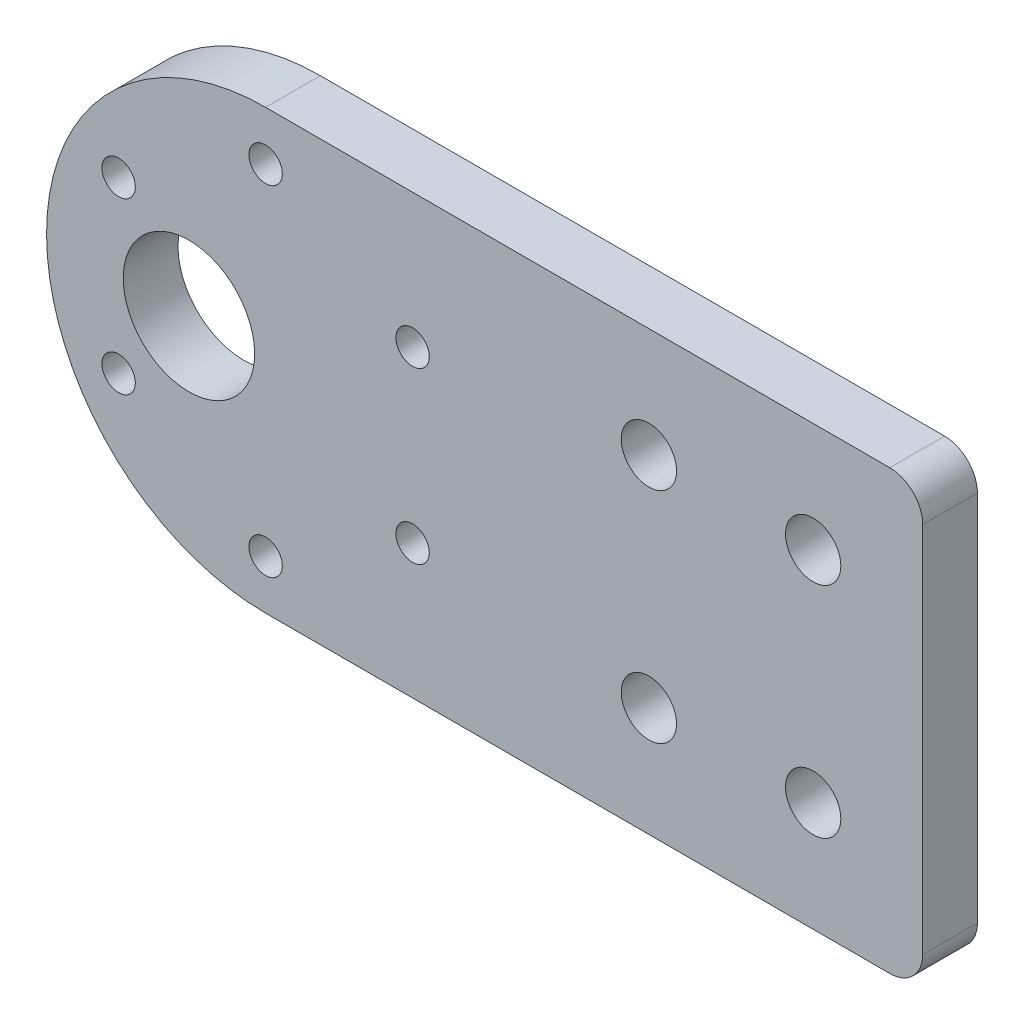
from build123d import *

# Parameters (mm, degrees)
SKETCH1_W           = 80
SKETCH1_H           = 40
BOSS_EXTRUDE1_DEPTH = 5
CUT_EXTRUDE4_REACH  = 91.582
CUT_EXTRUDE5_REACH  = 91.582
SKETCH11_R          = 2.525
FILLET1_R           = 3
CUT_EXTRUDE9_REACH  = 91.582
SKETCH19_R          = 1.525
SKETCH19_R_2        = 6


with BuildPart() as part:
    # Sketch1 → Boss-Extrude1 (new body)
    with BuildSketch(Plane.XY):
        with Locations((40, 20)):
            Rectangle(SKETCH1_W, SKETCH1_H)
    extrude(amount=BOSS_EXTRUDE1_DEPTH)

    # Sketch10 → Cut-Extrude4 (cut, up to next)
    with BuildSketch(Plane.XY.offset(5), mode=Mode.PRIVATE) as cut_extrude4_sk1:
        with BuildLine():
            ThreePointArc((20, 0), (5.857864376, 5.857864376), (0, 20))
            Line((0, 20), (0, 0))
            Line((0, 0), (20, 0))
        make_face()
    cut_extrude4_tool1 = extrude(cut_extrude4_sk1.sketch, amount=-CUT_EXTRUDE4_REACH, mode=Mode.PRIVATE) & part.part
    # Sketch10 → Cut-Extrude4 (cut, up to next)
    with BuildSketch(Plane.XY.offset(5), mode=Mode.PRIVATE) as cut_extrude4_sk2:
        with BuildLine():
            Line((20, 40), (0, 40))
            Line((0, 40), (0, 20))
            ThreePointArc((0, 20), (5.857864376, 34.142135624), (20, 40))
        make_face()
    cut_extrude4_tool2 = extrude(cut_extrude4_sk2.sketch, amount=-CUT_EXTRUDE4_REACH, mode=Mode.PRIVATE) & part.part
    add(cut_extrude4_tool1.solids().sort_by_distance((4.467359, 4.467359, 5))[0], mode=Mode.SUBTRACT)
    add(cut_extrude4_tool2.solids().sort_by_distance((4.467359, 35.532641, 5))[0], mode=Mode.SUBTRACT)

    # Sketch11 → Cut-Extrude5 (cut, up to next)
    with BuildSketch(Plane.XY.offset(5), mode=Mode.PRIVATE) as cut_extrude5_sk1:
        with Locations((55, 30)):
            Circle(SKETCH11_R)
    cut_extrude5_tool1 = extrude(cut_extrude5_sk1.sketch, amount=-CUT_EXTRUDE5_REACH, mode=Mode.PRIVATE) & part.part
    # Sketch11 → Cut-Extrude5 (cut, up to next)
    with BuildSketch(Plane.XY.offset(5), mode=Mode.PRIVATE) as cut_extrude5_sk2:
        with Locations((70, 30)):
            Circle(SKETCH11_R)
    cut_extrude5_tool2 = extrude(cut_extrude5_sk2.sketch, amount=-CUT_EXTRUDE5_REACH, mode=Mode.PRIVATE) & part.part
    # Sketch11 → Cut-Extrude5 (cut, up to next)
    with BuildSketch(Plane.XY.offset(5), mode=Mode.PRIVATE) as cut_extrude5_sk3:
        with Locations((55, 10)):
            Circle(SKETCH11_R)
    cut_extrude5_tool3 = extrude(cut_extrude5_sk3.sketch, amount=-CUT_EXTRUDE5_REACH, mode=Mode.PRIVATE) & part.part
    # Sketch11 → Cut-Extrude5 (cut, up to next)
    with BuildSketch(Plane.XY.offset(5), mode=Mode.PRIVATE) as cut_extrude5_sk4:
        with Locations((70, 10)):
            Circle(SKETCH11_R)
    cut_extrude5_tool4 = extrude(cut_extrude5_sk4.sketch, amount=-CUT_EXTRUDE5_REACH, mode=Mode.PRIVATE) & part.part
    add(cut_extrude5_tool1.solids().sort_by_distance((55, 30, 5))[0], mode=Mode.SUBTRACT)
    add(cut_extrude5_tool2.solids().sort_by_distance((70, 30, 5))[0], mode=Mode.SUBTRACT)
    add(cut_extrude5_tool3.solids().sort_by_distance((55, 10, 5))[0], mode=Mode.SUBTRACT)
    add(cut_extrude5_tool4.solids().sort_by_distance((70, 10, 5))[0], mode=Mode.SUBTRACT)

    # Fillet1
    fillet1_edges = [part.edges().sort_by_distance(p)[0] for p in [
        (80, 40, 2.5),
        (80, 0, 2.5),
    ]]
    fillet(fillet1_edges, radius=FILLET1_R)

    # Sketch19 → Cut-Extrude9 (cut, up to next)
    with BuildSketch(Plane.XY.offset(5), mode=Mode.PRIVATE) as cut_extrude9_sk1:
        with Locations((20, 35.5)):
            Circle(SKETCH19_R)
    cut_extrude9_tool1 = extrude(cut_extrude9_sk1.sketch, amount=-CUT_EXTRUDE9_REACH, mode=Mode.PRIVATE) & part.part
    # Sketch19 → Cut-Extrude9 (cut, up to next)
    with BuildSketch(Plane.XY.offset(5), mode=Mode.PRIVATE) as cut_extrude9_sk2:
        with Locations((33.423393759, 27.75)):
            Circle(SKETCH19_R)
    cut_extrude9_tool2 = extrude(cut_extrude9_sk2.sketch, amount=-CUT_EXTRUDE9_REACH, mode=Mode.PRIVATE) & part.part
    # Sketch19 → Cut-Extrude9 (cut, up to next)
    with BuildSketch(Plane.XY.offset(5), mode=Mode.PRIVATE) as cut_extrude9_sk3:
        with Locations((33.423393759, 12.25)):
            Circle(SKETCH19_R)
    cut_extrude9_tool3 = extrude(cut_extrude9_sk3.sketch, amount=-CUT_EXTRUDE9_REACH, mode=Mode.PRIVATE) & part.part
    # Sketch19 → Cut-Extrude9 (cut, up to next)
    with BuildSketch(Plane.XY.offset(5), mode=Mode.PRIVATE) as cut_extrude9_sk4:
        with Locations((20, 4.5)):
            Circle(SKETCH19_R)
    cut_extrude9_tool4 = extrude(cut_extrude9_sk4.sketch, amount=-CUT_EXTRUDE9_REACH, mode=Mode.PRIVATE) & part.part
    # Sketch19 → Cut-Extrude9 (cut, up to next)
    with BuildSketch(Plane.XY.offset(5), mode=Mode.PRIVATE) as cut_extrude9_sk5:
        with Locations((6.576606241, 12.25)):
            Circle(SKETCH19_R)
    cut_extrude9_tool5 = extrude(cut_extrude9_sk5.sketch, amount=-CUT_EXTRUDE9_REACH, mode=Mode.PRIVATE) & part.part
    # Sketch19 → Cut-Extrude9 (cut, up to next)
    with BuildSketch(Plane.XY.offset(5), mode=Mode.PRIVATE) as cut_extrude9_sk6:
        with Locations((6.576606241, 27.75)):
            Circle(SKETCH19_R)
    cut_extrude9_tool6 = extrude(cut_extrude9_sk6.sketch, amount=-CUT_EXTRUDE9_REACH, mode=Mode.PRIVATE) & part.part
    # Sketch19 → Cut-Extrude9 (cut, up to next)
    with BuildSketch(Plane.XY.offset(5), mode=Mode.PRIVATE) as cut_extrude9_sk7:
        with Locations((13, 20)):
            Circle(SKETCH19_R_2)
    cut_extrude9_tool7 = extrude(cut_extrude9_sk7.sketch, amount=-CUT_EXTRUDE9_REACH, mode=Mode.PRIVATE) & part.part
    add(cut_extrude9_tool1.solids().sort_by_distance((20, 35.5, 5))[0], mode=Mode.SUBTRACT)
    add(cut_extrude9_tool2.solids().sort_by_distance((33.423394, 27.75, 5))[0], mode=Mode.SUBTRACT)
    add(cut_extrude9_tool3.solids().sort_by_distance((33.423394, 12.25, 5))[0], mode=Mode.SUBTRACT)
    add(cut_extrude9_tool4.solids().sort_by_distance((20, 4.5, 5))[0], mode=Mode.SUBTRACT)
    add(cut_extrude9_tool5.solids().sort_by_distance((6.576606, 12.25, 5))[0], mode=Mode.SUBTRACT)
    add(cut_extrude9_tool6.solids().sort_by_distance((6.576606, 27.75, 5))[0], mode=Mode.SUBTRACT)
    add(cut_extrude9_tool7.solids().sort_by_distance((13, 20, 5))[0], mode=Mode.SUBTRACT)


solid = part.part
